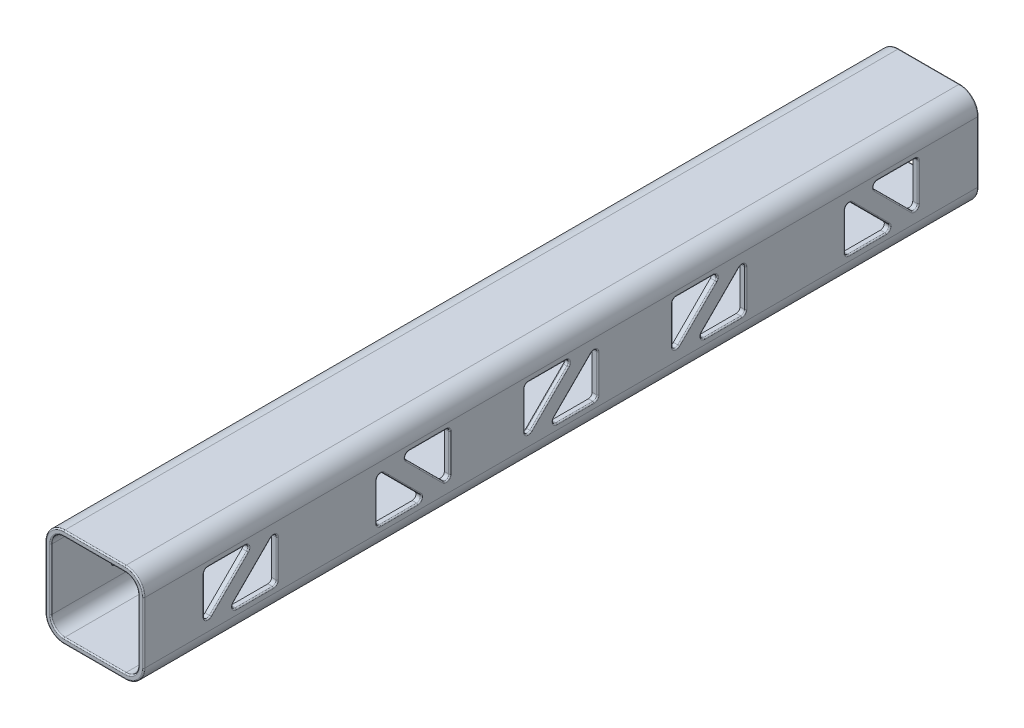
from build123d import *

# Parameters (mm, degrees)
BOSS_EXTRUDE1_DEPTH = 335
CUT_EXTRUDE1_DEPTH  = 45.5
FILLET1_R           = 1
FILLET2_R           = 1
FILLET3_R           = 1


with BuildPart() as part:
    # Sketch2 → Boss-Extrude1 (new, symmetric)
    with BuildSketch(Plane.XY):
        with BuildLine():
            Line((-24.5, 39.5), (24.5, 39.5))
            ThreePointArc((24.5, 39.5), (35.106601718, 35.106601718), (39.5, 24.5))
            Line((39.5, 24.5), (39.5, -24.5))
            ThreePointArc((39.5, -24.5), (35.106601718, -35.106601718), (24.5, -39.5))
            Line((24.5, -39.5), (-24.5, -39.5))
            ThreePointArc((-24.5, -39.5), (-35.106601718, -35.106601718), (-39.5, -24.5))
            Line((-39.5, -24.5), (-39.5, 24.5))
            ThreePointArc((-39.5, 24.5), (-35.106601718, 35.106601718), (-24.5, 39.5))
        make_face()
        with BuildLine():
            Line((-24.5, 35.024), (24.5, 35.024))
            ThreePointArc((24.5, 35.024), (31.941591765, 31.941591765), (35.024, 24.5))
            Line((35.024, 24.5), (35.024, -24.5))
            ThreePointArc((35.024, -24.5), (31.941591765, -31.941591765), (24.5, -35.024))
            Line((24.5, -35.024), (-24.5, -35.024))
            ThreePointArc((-24.5, -35.024), (-31.941591765, -31.941591765), (-35.024, -24.5))
            Line((-35.024, -24.5), (-35.024, 24.5))
            ThreePointArc((-35.024, 24.5), (-31.941591765, 31.941591765), (-24.5, 35.024))
        make_face(mode=Mode.SUBTRACT)
    extrude(amount=BOSS_EXTRUDE1_DEPTH, both=True)

    # Sketch3 → Cut-Extrude1 (cut, symmetric)
    with BuildSketch(Plane(origin=(0, 0, 0), x_dir=(0, 0, -1), z_dir=(1, 0, 0))):
        with BuildLine():
            Line((-286.493021498, -12.5504095), (-286.493021498, 17.206949813))
            ThreePointArc((-286.493021498, 17.206949813), (-285.614341841, 19.328270157), (-283.493021498, 20.206949813))
            Line((-283.493021498, 20.206949813), (-253.735662185, 20.206949813))
            ThreePointArc((-253.735662185, 20.206949813), (-250.964023587, 18.35500011), (-251.614341841, 15.085629469))
            Line((-251.614341841, 15.085629469), (-281.371701154, -14.671729843))
            ThreePointArc((-281.371701154, -14.671729843), (-284.641071795, -15.322048097), (-286.493021498, -12.5504095))
        make_face()
        with BuildLine():
            ThreePointArc((-233.008656046, 15.085629469), (-229.739285405, 15.735947723), (-227.887335702, 12.964309126))
            Line((-227.887335702, 12.964309126), (-227.887335702, -16.793050187))
            ThreePointArc((-227.887335702, -16.793050187), (-228.766015358, -18.914370531), (-230.887335702, -19.793050187))
            Line((-230.887335702, -19.793050187), (-260.644695015, -19.793050187))
            ThreePointArc((-260.644695015, -19.793050187), (-263.416333612, -17.941100484), (-262.766015358, -14.671729843))
            Line((-262.766015358, -14.671729843), (-233.008656046, 15.085629469))
        make_face()
        with BuildLine():
            Line((-142.766015358, 15.085629469), (-113.008656046, -14.671729843))
            ThreePointArc((-113.008656046, -14.671729843), (-112.358337792, -17.941100484), (-115.129976389, -19.793050187))
            Line((-115.129976389, -19.793050187), (-144.887335702, -19.793050187))
            ThreePointArc((-144.887335702, -19.793050187), (-147.008656046, -18.914370531), (-147.887335702, -16.793050187))
            Line((-147.887335702, -16.793050187), (-147.887335702, 12.964309126))
            ThreePointArc((-147.887335702, 12.964309126), (-146.035385999, 15.735947723), (-142.766015358, 15.085629469))
        make_face()
        with BuildLine():
            ThreePointArc((-89.281649906, -12.5504095), (-91.133599609, -15.322048097), (-94.40297025, -14.671729843))
            Line((-94.40297025, -14.671729843), (-124.160329563, 15.085629469))
            ThreePointArc((-124.160329563, 15.085629469), (-124.810647817, 18.35500011), (-122.039009219, 20.206949813))
            Line((-122.039009219, 20.206949813), (-92.281649906, 20.206949813))
            ThreePointArc((-92.281649906, 20.206949813), (-90.160329563, 19.328270157), (-89.281649906, 17.206949813))
            Line((-89.281649906, 17.206949813), (-89.281649906, -12.5504095))
        make_face()
        with BuildLine():
            ThreePointArc((3.475709407, 20.206949813), (6.247348004, 18.35500011), (5.59702975, 15.085629469))
            Line((5.59702975, 15.085629469), (-24.160329563, -14.671729843))
            ThreePointArc((-24.160329563, -14.671729843), (-27.429700203, -15.322048097), (-29.281649906, -12.5504095))
            Line((-29.281649906, -12.5504095), (-29.281649906, 17.206949813))
            ThreePointArc((-29.281649906, 17.206949813), (-28.40297025, 19.328270157), (-26.281649906, 20.206949813))
            Line((-26.281649906, 20.206949813), (3.475709407, 20.206949813))
        make_face()
        with BuildLine():
            ThreePointArc((24.202715546, 15.085629469), (27.472086187, 15.735947723), (29.324035889, 12.964309126))
            Line((29.324035889, 12.964309126), (29.324035889, -16.793050187))
            ThreePointArc((29.324035889, -16.793050187), (28.445356233, -18.914370531), (26.324035889, -19.793050187))
            Line((26.324035889, -19.793050187), (-3.433323423, -19.793050187))
            ThreePointArc((-3.433323423, -19.793050187), (-6.204962021, -17.941100484), (-5.554643767, -14.671729843))
            Line((-5.554643767, -14.671729843), (24.202715546, 15.085629469))
        make_face()
        with BuildLine():
            Line((142.808401342, 15.085629469), (113.051042029, -14.671729843))
            ThreePointArc((113.051042029, -14.671729843), (112.400723775, -17.941100484), (115.172362372, -19.793050187))
            Line((115.172362372, -19.793050187), (144.929721685, -19.793050187))
            ThreePointArc((144.929721685, -19.793050187), (147.051042029, -18.914370531), (147.929721685, -16.793050187))
            Line((147.929721685, -16.793050187), (147.929721685, 12.964309126))
            ThreePointArc((147.929721685, 12.964309126), (146.077771982, 15.735947723), (142.808401342, 15.085629469))
        make_face()
        with BuildLine():
            Line((92.324035889, 20.206949813), (122.081395202, 20.206949813))
            ThreePointArc((122.081395202, 20.206949813), (124.8530338, 18.35500011), (124.202715546, 15.085629469))
            Line((124.202715546, 15.085629469), (94.445356233, -14.671729843))
            ThreePointArc((94.445356233, -14.671729843), (91.175985592, -15.322048097), (89.324035889, -12.5504095))
            Line((89.324035889, -12.5504095), (89.324035889, 17.206949813))
            ThreePointArc((89.324035889, 17.206949813), (90.202715546, 19.328270157), (92.324035889, 20.206949813))
        make_face()
        with BuildLine():
            Line((233.051042029, 15.085629469), (262.808401342, -14.671729843))
            ThreePointArc((262.808401342, -14.671729843), (263.458719596, -17.941100484), (260.687080998, -19.793050187))
            Line((260.687080998, -19.793050187), (230.929721685, -19.793050187))
            ThreePointArc((230.929721685, -19.793050187), (228.808401342, -18.914370531), (227.929721685, -16.793050187))
            Line((227.929721685, -16.793050187), (227.929721685, 12.964309126))
            ThreePointArc((227.929721685, 12.964309126), (229.781671388, 15.735947723), (233.051042029, 15.085629469))
        make_face()
        with BuildLine():
            ThreePointArc((286.535407481, -12.5504095), (284.683457778, -15.322048097), (281.414087137, -14.671729843))
            Line((281.414087137, -14.671729843), (251.656727824, 15.085629469))
            ThreePointArc((251.656727824, 15.085629469), (251.00640957, 18.35500011), (253.778048168, 20.206949813))
            Line((253.778048168, 20.206949813), (283.535407481, 20.206949813))
            ThreePointArc((283.535407481, 20.206949813), (285.656727824, 19.328270157), (286.535407481, 17.206949813))
            Line((286.535407481, 17.206949813), (286.535407481, -12.5504095))
        make_face()
    extrude(amount=CUT_EXTRUDE1_DEPTH, both=True, mode=Mode.SUBTRACT)

    # Fillet1
    fillet1_edges = [part.edges().sort_by_distance(p)[0] for p in [
        (39.5, 0, -335),
        (35.106601718, -35.106601718, -335),
        (0, -39.5, -335),
        (-35.106601718, -35.106601718, -335),
        (35.106601718, -35.106601718, 335),
        (39.5, 0, 335),
        (35.106601718, 35.106601718, 335),
        (0, 39.5, 335),
        (-31.941591765, 31.941591765, -335),
        (-35.024, 0, -335),
        (-31.941591765, -31.941591765, -335),
        (0, -35.024, -335),
        (-35.106601718, 35.106601718, 335),
        (31.941591765, -31.941591765, -335),
        (35.024, 0, -335),
        (31.941591765, 31.941591765, -335),
        (0, 35.024, -335),
        (-31.941591765, 31.941591765, 335),
        (-35.024, 0, 335),
        (-31.941591765, -31.941591765, 335),
        (0, -35.024, 335),
        (31.941591765, -31.941591765, 335),
        (35.024, 0, 335),
        (31.941591765, 31.941591765, 335),
        (-39.5, 0, 335),
        (0, 35.024, 335),
        (-35.106601718, -35.106601718, 335),
        (-39.5, 0, -335),
        (0, -39.5, 335),
        (-35.106601718, 35.106601718, -335),
        (0, 39.5, -335),
        (35.106601718, 35.106601718, -335),
    ]]
    fillet(fillet1_edges, radius=FILLET1_R)

    # Fillet2
    fillet2_edges = [part.edges().sort_by_distance(p)[0] for p in [
        (39.5, -18.914370531, -28.445356233),
        (39.5, -19.793050187, -11.445356233),
        (39.5, -17.941100484, 6.204962021),
        (39.5, 0.206949813, -9.324035889),
        (39.5, 15.735947723, -27.472086187),
        (39.5, -1.914370531, -29.324035889),
        (39.5, 0.206949813, -127.929721685),
        (39.5, -18.914370531, -147.051042029),
        (39.5, -19.793050187, -130.051042029),
        (39.5, -17.941100484, -112.400723775),
        (39.5, 15.735947723, -146.077771982),
        (39.5, -1.914370531, -147.929721685),
        (39.5, -15.322048097, -91.175985592),
        (39.5, 19.328270157, -90.202715546),
        (39.5, 20.206949813, -107.202715546),
        (39.5, 18.35500011, -124.8530338),
        (39.5, 0.206949813, -109.324035889),
        (39.5, 2.328270157, -89.324035889),
        (39.5, -1.914370531, -227.929721685),
        (39.5, 15.735947723, -229.781671388),
        (39.5, 0.206949813, -247.929721685),
        (39.5, -17.941100484, -263.458719596),
        (39.5, -19.793050187, -245.808401342),
        (39.5, -18.914370531, -228.808401342),
        (39.5, -18.914370531, 228.766015358),
        (39.5, -19.793050187, 245.766015358),
        (39.5, -17.941100484, 263.416333612),
        (39.5, 0.206949813, 247.887335702),
        (39.5, 15.735947723, 229.739285405),
        (39.5, -1.914370531, 227.887335702),
        (39.5, -1.914370531, 147.887335702),
        (39.5, 15.735947723, 146.035385999),
        (39.5, 0.206949813, 127.887335702),
        (39.5, -17.941100484, 112.358337792),
        (39.5, -19.793050187, 130.008656046),
        (39.5, -18.914370531, 147.008656046),
        (39.5, 0.206949813, 109.281649906),
        (39.5, 18.35500011, 124.810647817),
        (39.5, 20.206949813, 107.160329563),
        (39.5, 2.328270157, 89.281649906),
        (39.5, -15.322048097, 91.133599609),
        (39.5, 19.328270157, 90.160329563),
        (39.5, -15.322048097, 27.429700203),
        (39.5, 19.328270157, 28.40297025),
        (39.5, 18.35500011, -6.247348004),
        (39.5, 0.206949813, 9.281649906),
        (39.5, 2.328270157, 29.281649906),
        (39.5, 20.206949813, 11.40297025),
        (39.5, 0.206949813, -266.535407481),
        (39.5, 18.35500011, -251.00640957),
        (39.5, 20.206949813, -268.656727824),
        (39.5, 2.328270157, -286.535407481),
        (39.5, -15.322048097, -284.683457778),
        (39.5, 19.328270157, -285.656727824),
        (39.5, 19.328270157, 285.614341841),
        (39.5, -15.322048097, 284.641071795),
        (39.5, 2.328270157, 286.493021498),
        (39.5, 20.206949813, 268.614341841),
        (39.5, 18.35500011, 250.964023587),
        (39.5, 0.206949813, 266.493021498),
        (35.024, 20.206949813, 11.40297025),
        (35.024, 19.328270157, 28.40297025),
        (35.024, 2.328270157, 29.281649906),
        (35.024, -15.322048097, 27.429700203),
        (35.024, 0.206949813, 9.281649906),
        (35.024, 18.35500011, -6.247348004),
    ]]
    fillet(fillet2_edges, radius=FILLET2_R)

    # Fillet3
    fillet3_edges = [part.edges().sort_by_distance(p)[0] for p in [
        (-39.5, 15.735947723, -27.472086187),
        (-39.5, -1.914370531, -29.324035889),
        (-39.5, -18.914370531, -28.445356233),
        (-39.5, -19.793050187, -11.445356233),
        (-39.5, -17.941100484, 6.204962021),
        (-39.5, 0.206949813, -9.324035889),
        (-39.5, 0.206949813, -127.929721685),
        (-39.5, 15.735947723, -146.077771982),
        (-39.5, -1.914370531, -147.929721685),
        (-39.5, -18.914370531, -147.051042029),
        (-39.5, -19.793050187, -130.051042029),
        (-39.5, -17.941100484, -112.400723775),
        (-39.5, 20.206949813, -107.202715546),
        (-39.5, 18.35500011, -124.8530338),
        (-39.5, 0.206949813, -109.324035889),
        (-39.5, -15.322048097, -91.175985592),
        (-39.5, 2.328270157, -89.324035889),
        (-39.5, 19.328270157, -90.202715546),
        (-39.5, 0.206949813, -247.929721685),
        (-39.5, -17.941100484, -263.458719596),
        (-39.5, -19.793050187, -245.808401342),
        (-39.5, -18.914370531, -228.808401342),
        (-39.5, -1.914370531, -227.929721685),
        (-39.5, 15.735947723, -229.781671388),
        (-39.5, 15.735947723, 229.739285405),
        (-39.5, -1.914370531, 227.887335702),
        (-39.5, -18.914370531, 228.766015358),
        (-39.5, -19.793050187, 245.766015358),
        (-39.5, -17.941100484, 263.416333612),
        (-39.5, 0.206949813, 247.887335702),
        (-39.5, 0.206949813, 127.887335702),
        (-39.5, -17.941100484, 112.358337792),
        (-39.5, -19.793050187, 130.008656046),
        (-39.5, -18.914370531, 147.008656046),
        (-39.5, -1.914370531, 147.887335702),
        (-39.5, 15.735947723, 146.035385999),
        (-39.5, -15.322048097, 91.133599609),
        (-39.5, 0.206949813, 109.281649906),
        (-39.5, 18.35500011, 124.810647817),
        (-39.5, 20.206949813, 107.160329563),
        (-39.5, 19.328270157, 90.160329563),
        (-39.5, 2.328270157, 89.281649906),
        (-39.5, 18.35500011, -6.247348004),
        (-39.5, 0.206949813, 9.281649906),
        (-39.5, -15.322048097, 27.429700203),
        (-39.5, 2.328270157, 29.281649906),
        (-39.5, 19.328270157, 28.40297025),
        (-39.5, 20.206949813, 11.40297025),
        (-39.5, -15.322048097, -284.683457778),
        (-39.5, 0.206949813, -266.535407481),
        (-39.5, 18.35500011, -251.00640957),
        (-39.5, 20.206949813, -268.656727824),
        (-39.5, 19.328270157, -285.656727824),
        (-39.5, 2.328270157, -286.535407481),
        (-39.5, 2.328270157, 286.493021498),
        (-39.5, 19.328270157, 285.614341841),
        (-39.5, 20.206949813, 268.614341841),
        (-39.5, 18.35500011, 250.964023587),
        (-39.5, 0.206949813, 266.493021498),
        (-39.5, -15.322048097, 284.641071795),
    ]]
    fillet(fillet3_edges, radius=FILLET3_R)


solid = part.part
